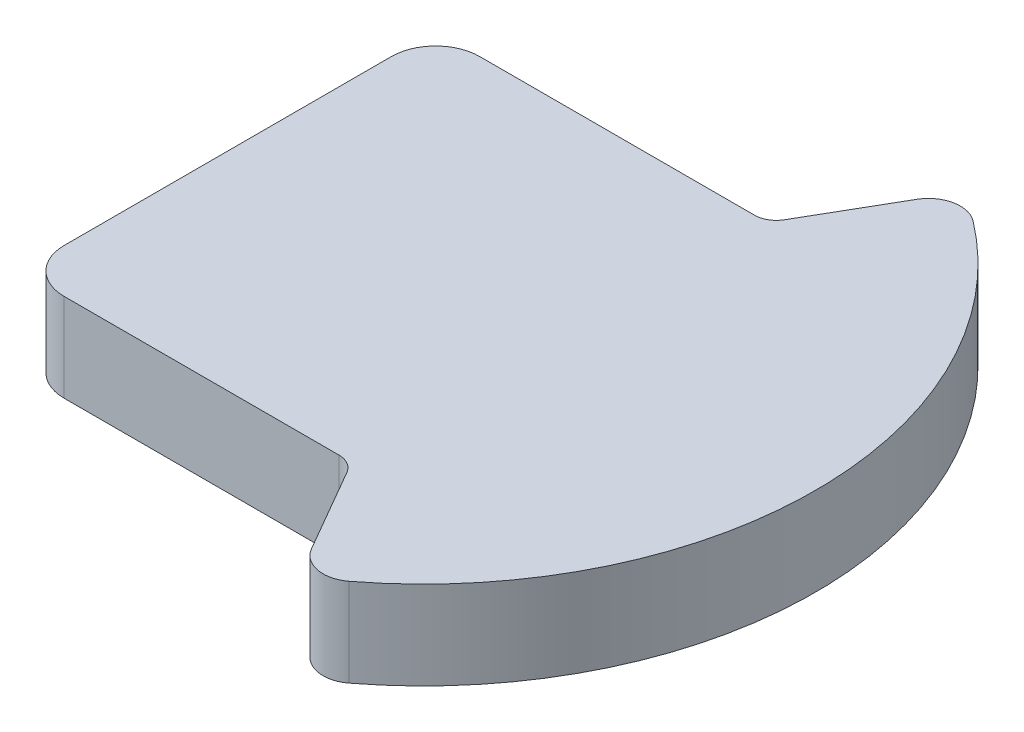
from build123d import *

# Parameters (mm, degrees)
EXTRUDE4_DEPTH = 12.7


with BuildPart() as part:
    # Sketch9 → Extrude4 (new body)
    with BuildSketch(Plane(origin=(0, 0, 0), x_dir=(1, 0, 0), z_dir=(0, 1, 0))):
        with BuildLine():
            Line((20.495684684, 31.492994432), (27.472430394, 43.577072472))
            ThreePointArc((27.472430394, 43.577072472), (30.531314315, 45.773497268), (34.201168909, 44.928973738))
            ThreePointArc((34.201168909, 44.928973738), (56.465322419, 0), (34.201168909, -44.928973738))
            ThreePointArc((34.201168909, -44.928973738), (30.531314315, -45.773497268), (27.472430394, -43.577072472))
            Line((27.472430394, -43.577072472), (20.495684684, -31.492994432))
            ThreePointArc((20.495684684, -31.492994432), (19.333554027, -30.330863775), (17.746054027, -29.905494432))
            Line((17.746054027, -29.905494432), (-21.795601412, -29.905494432))
            ThreePointArc((-21.795601412, -29.905494432), (-26.285729472, -28.045622492), (-28.145601412, -23.555494432))
            Line((-28.145601412, -23.555494432), (-28.145601412, 23.555494432))
            ThreePointArc((-28.145601412, 23.555494432), (-26.285729472, 28.045622492), (-21.795601412, 29.905494432))
            Line((-21.795601412, 29.905494432), (17.746054027, 29.905494432))
            ThreePointArc((17.746054027, 29.905494432), (19.333554027, 30.330863775), (20.495684684, 31.492994432))
        make_face()
    extrude(amount=-EXTRUDE4_DEPTH)


solid = part.part
